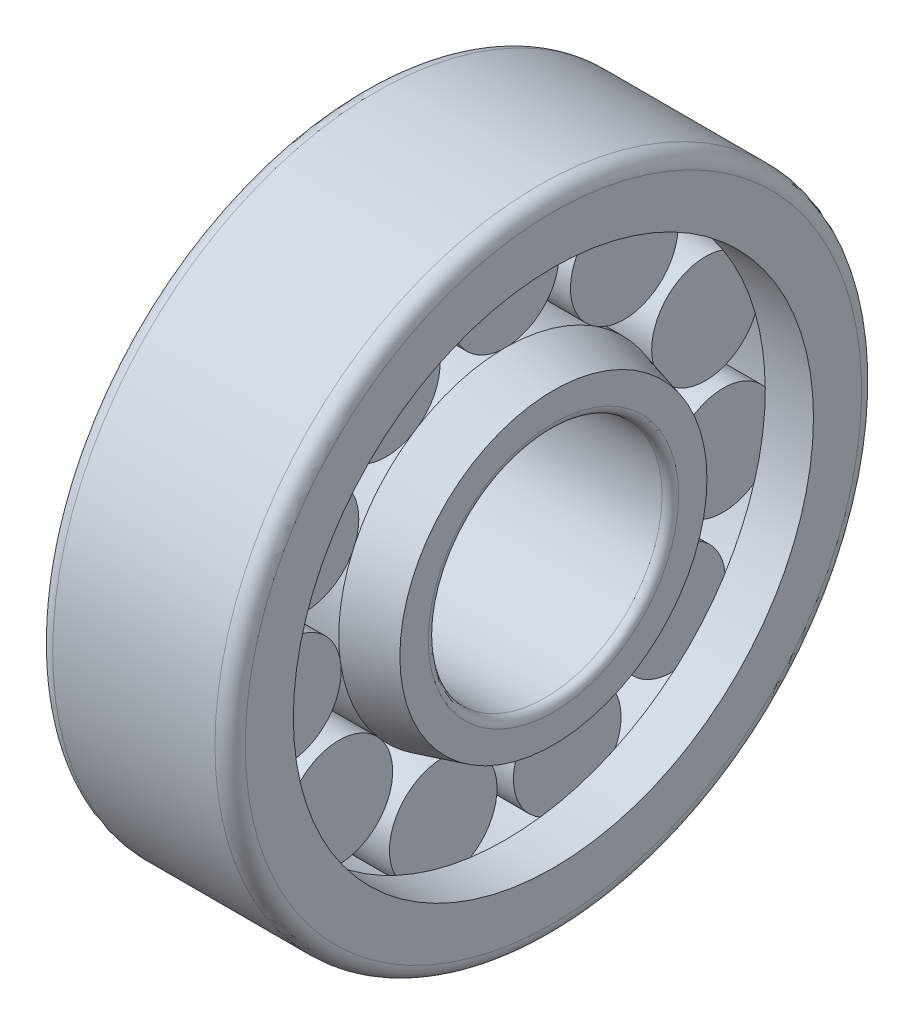
from build123d import *

# Parameters (mm, degrees)
SKETCH2_W               = 7
SKETCH2_H               = 3.91
CIRCULAR_PATTERN1_COUNT = 11
FILLET1_R               = 1.1
FILLET2_R               = 0.6


with BuildPart() as part:
    # Sketch1 → Revolve1 (revolve)
    with BuildSketch(Plane.XY, mode=Mode.PRIVATE) as revolve1_sk:
        Polygon((-7, 8.5), (7, 8.5), (7, 11.162177826), (3.5, 12.1), (-3.5, 12.1), (-7, 11.162177826), align=None)
    revolve(revolve1_sk.sketch.rotate(Axis((-10.137871204, 0, 0), (1, 0, 0)), 90), axis=Axis((-10.137871204, 0, 0), (1, 0, 0)))

    # Sketch2 → Revolve2 (revolve)
    with BuildSketch(Plane.XY):
        with Locations((0, 14.045)):
            Rectangle(SKETCH2_W, SKETCH2_H)
    revolve2 = revolve(axis=Axis((-7.422783257, 16, 0), (1, 0, 0)))

    # Sketch3 → Revolve3 (revolve)
    with BuildSketch(Plane.XY, mode=Mode.PRIVATE) as revolve3_sk:
        Polygon((-7, 23.5), (7, 23.5), (7, 18.905), (3.49, 18.905), (3.49, 19.9), (-3.49, 19.9), (-3.49, 18.905), (-7, 18.905), align=None)
    revolve(revolve3_sk.sketch.rotate(Axis((-9.082213196, 0, 0), (1, 0, 0)), 90), axis=Axis((-9.082213196, 0, 0), (1, 0, 0)))

    # Circular-Pattern1: Revolve2 ×11 about axis
    circular_pattern1_axis = Axis((0, 0, 0), (1, 0, 0))
    for i in range(1, CIRCULAR_PATTERN1_COUNT):
        add(revolve2.rotate(circular_pattern1_axis, i * 360 / CIRCULAR_PATTERN1_COUNT))

    # Fillet1
    fillet1_edges = [part.edges().sort_by_distance(p)[0] for p in [
        (-7, 0, -23.5),
        (7, 0, -23.5),
    ]]
    fillet(fillet1_edges, radius=FILLET1_R)

    # Fillet2
    fillet2_edges = [part.edges().sort_by_distance(p)[0] for p in [
        (7, 0, -8.5),
        (-7, 0, -8.5),
    ]]
    fillet(fillet2_edges, radius=FILLET2_R)


solid = part.part
